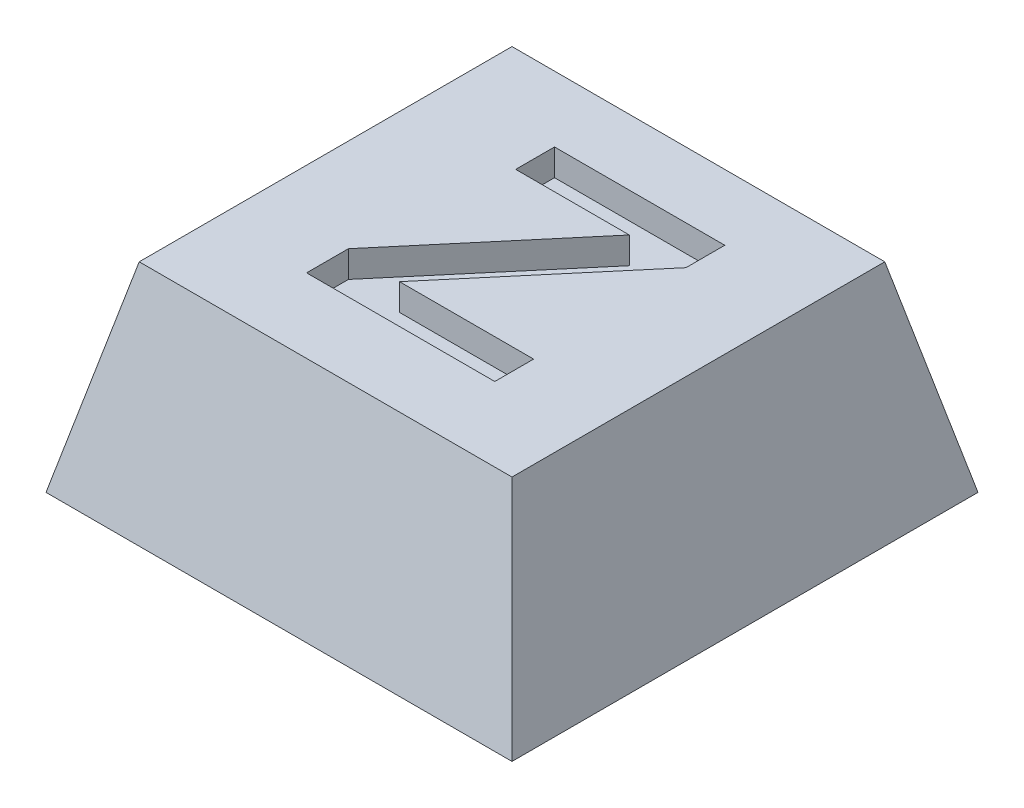
from build123d import *

# Parameters (mm, degrees)
SKETCH1_W           = 7
SKETCH1_H           = 7
BOSS_EXTRUDE1_DEPTH = 3
CUT_EXTRUDE1_DEPTH  = 7
CUT_EXTRUDE2_DEPTH  = 11
SKETCH4_R           = 1.8
CUT_EXTRUDE3_DEPTH  = 0.8
CUT_EXTRUDE4_DEPTH  = 0.4


with BuildPart() as part:
    # Sketch1 → Boss-Extrude1 (new body)
    with BuildSketch(Plane(origin=(0, 0, 0), x_dir=(1, 0, 0), z_dir=(0, 1, 0))):
        with Locations((3.5, 3.5)):
            Rectangle(SKETCH1_W, SKETCH1_H)
    extrude(amount=BOSS_EXTRUDE1_DEPTH)

    # Sketch2 → Cut-Extrude1 (cut)
    with BuildSketch(Plane.XY):
        Polygon((0, 0), (0.7, 3), (0, 3), align=None)
        Polygon((7, 0), (6.3, 3), (7, 3), align=None)
    extrude(amount=-CUT_EXTRUDE1_DEPTH, mode=Mode.SUBTRACT)

    # Sketch3 → Cut-Extrude2 (cut)
    with BuildSketch(Plane(origin=(0, 0, 0), x_dir=(0, 0, -1), z_dir=(1, 0, 0))):
        Polygon((0, 0), (0.7, 3), (0, 3), align=None)
        Polygon((7, 3), (6.3, 3), (7, 0), align=None)
    extrude(amount=CUT_EXTRUDE2_DEPTH, mode=Mode.SUBTRACT)

    # Sketch4 → Cut-Extrude3 (cut)
    with BuildSketch(Plane.XZ):
        with Locations(Location((3.5, -3.5, 0), (0, 0, 270))):
            Circle(SKETCH4_R)
    extrude(amount=-CUT_EXTRUDE3_DEPTH, mode=Mode.SUBTRACT)

    # Sketch5 → Cut-Extrude4 (cut)
    with BuildSketch(Plane(origin=(0, 3, 0), x_dir=(1, 0, 0), z_dir=(0, 1, 0))):
        Polygon((2.101020722, 1.813258093), (2.101020722, 2.441463221), (4.031910145, 4.729924759), (2.325379696, 4.729924759), (2.325379696, 5.313258093), (4.883072004, 5.313258093), (4.883072004, 4.729924759), (2.913620882, 2.396591426), (4.927943799, 2.396591426), (4.927943799, 1.813258093), align=None)
    extrude(amount=-CUT_EXTRUDE4_DEPTH, mode=Mode.SUBTRACT)


solid = part.part
